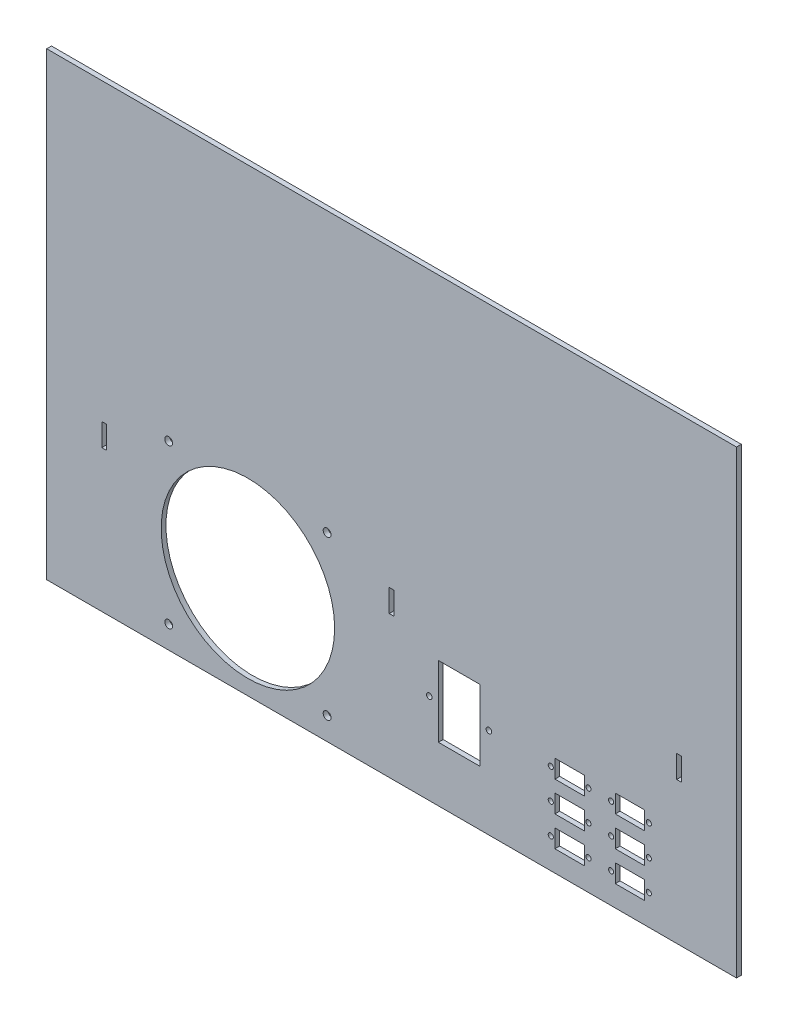
from build123d import *

# Parameters (mm, degrees)
SKETCH1_W           = 457.2
SKETCH1_H           = 304.8
ACRYLIC_PANEL_DEPTH = 3.175
SKETCH2_R           = 2.6
SKETCH2_R_2         = 57.5
SKETCH2_R_3         = 1.85
SKETCH2_R_4         = 1.7
SKETCH2_W           = 3.175
SKETCH2_H           = 15
SKETCH2_W_2         = 19.5
SKETCH2_H_2         = 12
SKETCH2_W_3         = 27.5
SKETCH2_H_3         = 47
CUT_EXTRUDE1_DEPTH  = 275.761352131


with BuildPart() as part:
    # Sketch1 → Acrylic Panel (new body)
    with BuildSketch(Plane.XY):
        Rectangle(SKETCH1_W, SKETCH1_H)
    extrude(amount=ACRYLIC_PANEL_DEPTH)

    # Sketch2 → Cut-Extrude1 (cut, through all)
    with BuildSketch(Plane.XY.offset(3.175)):
        with Locations((-147.75, -32.4)):
            Circle(SKETCH2_R)
        with Locations((-42.75, -32.4)):
            Circle(SKETCH2_R)
        with Locations((-147.75, -137.4)):
            Circle(SKETCH2_R)
        with Locations((-42.75, -137.4)):
            Circle(SKETCH2_R)
        with Locations((-95.25, -84.9)):
            Circle(SKETCH2_R_2)
        with Locations((25, -92.4)):
            Circle(SKETCH2_R_3)
        with Locations((64.5, -92.4)):
            Circle(SKETCH2_R_3)
        with Locations((105.5, -132.4)):
            Circle(SKETCH2_R_4)
        with Locations((130.5, -132.4)):
            Circle(SKETCH2_R_4)
        with Locations((145.5, -132.4)):
            Circle(SKETCH2_R_4)
        with Locations((170.5, -132.4)):
            Circle(SKETCH2_R_4)
        with Locations((145.5, -112.4)):
            Circle(SKETCH2_R_4)
        with Locations((170.5, -112.4)):
            Circle(SKETCH2_R_4)
        with Locations((145.5, -92.4)):
            Circle(SKETCH2_R_4)
        with Locations((170.5, -92.4)):
            Circle(SKETCH2_R_4)
        with Locations((105.5, -112.4)):
            Circle(SKETCH2_R_4)
        with Locations((130.5, -112.4)):
            Circle(SKETCH2_R_4)
        with Locations((105.5, -92.4)):
            Circle(SKETCH2_R_4)
        with Locations((130.5, -92.4)):
            Circle(SKETCH2_R_4)
        with Locations((0, -50.8)):
            Rectangle(SKETCH2_W, SKETCH2_H)
        with Locations((190.5, -50.8)):
            Rectangle(SKETCH2_W, SKETCH2_H)
        with Locations((-190.5, -50.8)):
            Rectangle(SKETCH2_W, SKETCH2_H)
        with Locations((118, -132.4)):
            Rectangle(SKETCH2_W_2, SKETCH2_H_2)
        with Locations((158, -132.4)):
            Rectangle(SKETCH2_W_2, SKETCH2_H_2)
        with Locations((158, -112.4)):
            Rectangle(SKETCH2_W_2, SKETCH2_H_2)
        with Locations((158, -92.4)):
            Rectangle(SKETCH2_W_2, SKETCH2_H_2)
        with Locations((118, -112.4)):
            Rectangle(SKETCH2_W_2, SKETCH2_H_2)
        with Locations((118, -92.4)):
            Rectangle(SKETCH2_W_2, SKETCH2_H_2)
        with Locations((44.75, -92.4)):
            Rectangle(SKETCH2_W_3, SKETCH2_H_3)
    extrude(amount=-CUT_EXTRUDE1_DEPTH, mode=Mode.SUBTRACT)


solid = part.part
